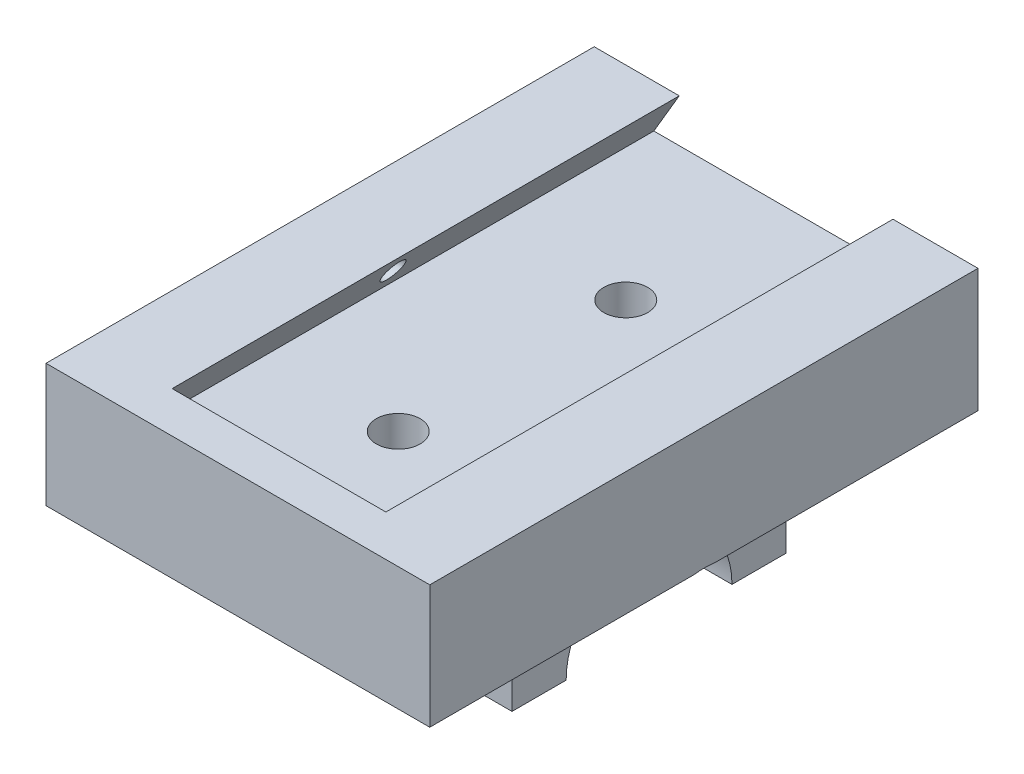
from build123d import *

# Parameters (mm, degrees)
SKETCH1_W                   = 56
SKETCH1_H                   = 18
CHANNEL_BLOCK_DEPTH         = 40
SKETCH2_W                   = 40
SKETCH2_H                   = 12.5
CLAMP_UPPER_HALF_DEPTH      = 20
DOVETAIL_CHANNEL_DEPTH      = 34
DOVETAIL_CHANNEL_DEPTH_BACK = 41
HANDLEBAR_BORE_DEPTH        = 53.038447325
HANDLEBAR_BORE_DEPTH_BACK   = 53.038447325
SKETCH4_R                   = 12.1
M5_INSERT_HOLES_DEPTH       = 53.038447325
M5_INSERT_HOLES_DEPTH_BACK  = 53.038447325
SKETCH5_R                   = 3.2
SKETCH6_R                   = 1.65
LOCK_SCREW_HOLE_DEPTH       = 53.038447325


with BuildPart() as part:
    # Sketch1 → Channel Block (new, symmetric)
    with BuildSketch(Plane.XY):
        with Locations((0, 9)):
            Rectangle(SKETCH1_W, SKETCH1_H)
    extrude(amount=CHANNEL_BLOCK_DEPTH, both=True)

    # Sketch2 → Clamp Upper Half (add, symmetric)
    with BuildSketch(Plane(origin=(0, 0, 0), x_dir=(0, 0, -1), z_dir=(1, 0, 0))):
        with Locations((0, -5.75)):
            Rectangle(SKETCH2_W, SKETCH2_H)
    extrude(amount=CLAMP_UPPER_HALF_DEPTH, both=True)

    # Sketch3 → Dovetail Channel (cut, two sides: drawn at the far end of the back side and taken through both)
    with BuildSketch(Plane.XY.offset(-DOVETAIL_CHANNEL_DEPTH_BACK)):
        Polygon((-15.3, 18.5), (15.3, 18.5), (19.3, 11.7), (-19.3, 11.7), align=None)
    extrude(amount=DOVETAIL_CHANNEL_DEPTH + DOVETAIL_CHANNEL_DEPTH_BACK, mode=Mode.SUBTRACT)

    # Sketch4 → Handlebar Bore (cut, two sides: drawn at the far end of the back side and taken through both)
    with BuildSketch(Plane(origin=(0, 0, 0), x_dir=(0, 0, -1), z_dir=(1, 0, 0)).offset(-HANDLEBAR_BORE_DEPTH_BACK)):
        with Locations((0, -12)):
            Circle(SKETCH4_R)
    extrude(amount=HANDLEBAR_BORE_DEPTH + HANDLEBAR_BORE_DEPTH_BACK, mode=Mode.SUBTRACT)

    # Sketch5 → M5 Insert Holes (cut, two sides: drawn at the far end of the back side and taken through both)
    with BuildSketch(Plane(origin=(0, 0, 0), x_dir=(1, 0, 0), z_dir=(0, 1, 0)).offset(-M5_INSERT_HOLES_DEPTH_BACK)):
        with Locations(Location((0, -16.6, 0), (0, 0, 270))):
            Circle(SKETCH5_R)
        with Locations(Location((0, 16.6, 0), (0, 0, 270))):
            Circle(SKETCH5_R)
    extrude(amount=M5_INSERT_HOLES_DEPTH + M5_INSERT_HOLES_DEPTH_BACK, mode=Mode.SUBTRACT)

    # Sketch6 → Lock Screw Hole (cut, through all)
    with BuildSketch(Plane(origin=(0, 0, 0), x_dir=(0, 0, -1), z_dir=(1, 0, 0))):
        with Locations((0, 15)):
            Circle(SKETCH6_R)
    extrude(amount=-LOCK_SCREW_HOLE_DEPTH, mode=Mode.SUBTRACT)


solid = part.part
